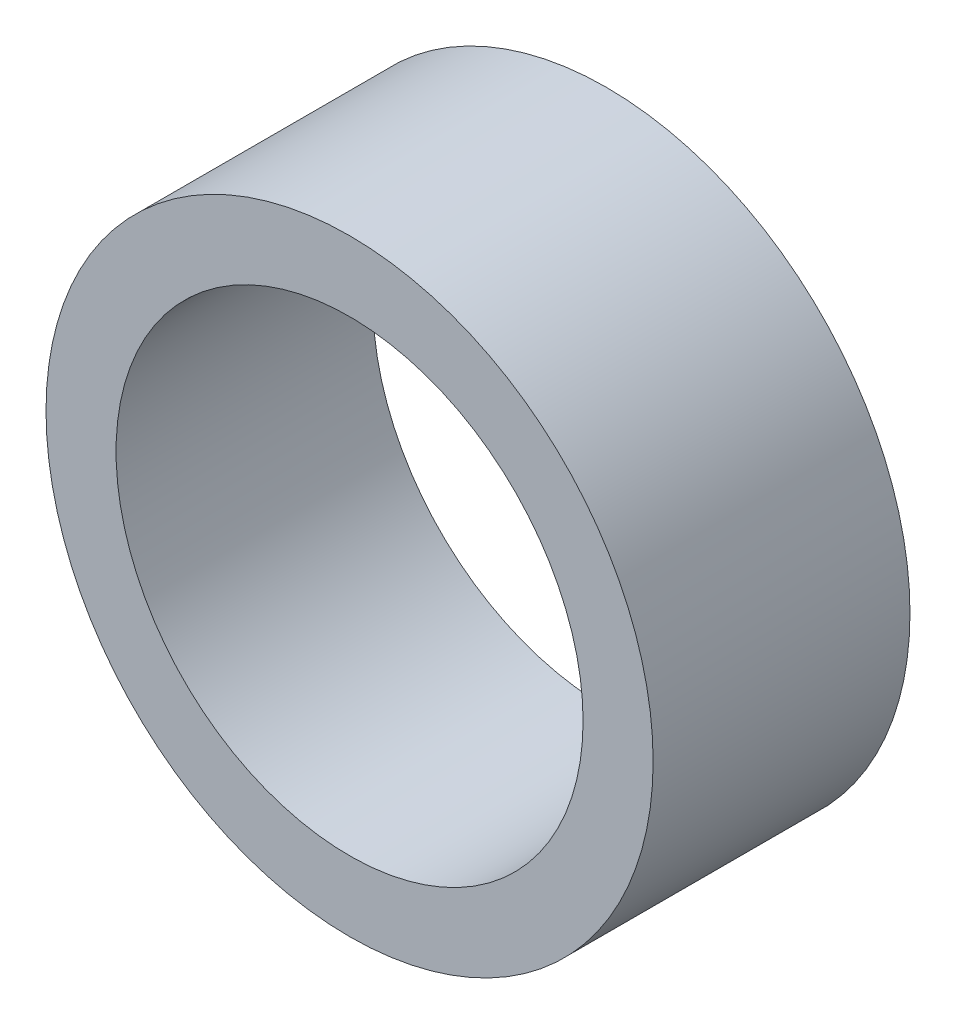
from build123d import *

# Parameters (mm, degrees)
SKIZZE1_R                       = 6.5
SKIZZE1_R_2                     = 5
AUFSATZ_LINEAR_AUSTRAGEN1_DEPTH = 5.5


with BuildPart() as part:
    # Skizze1 → Aufsatz-Linear austragen1 (new body)
    with BuildSketch(Plane.XY):
        Circle(SKIZZE1_R)
        Circle(SKIZZE1_R_2, mode=Mode.SUBTRACT)
    extrude(amount=AUFSATZ_LINEAR_AUSTRAGEN1_DEPTH)


solid = part.part
